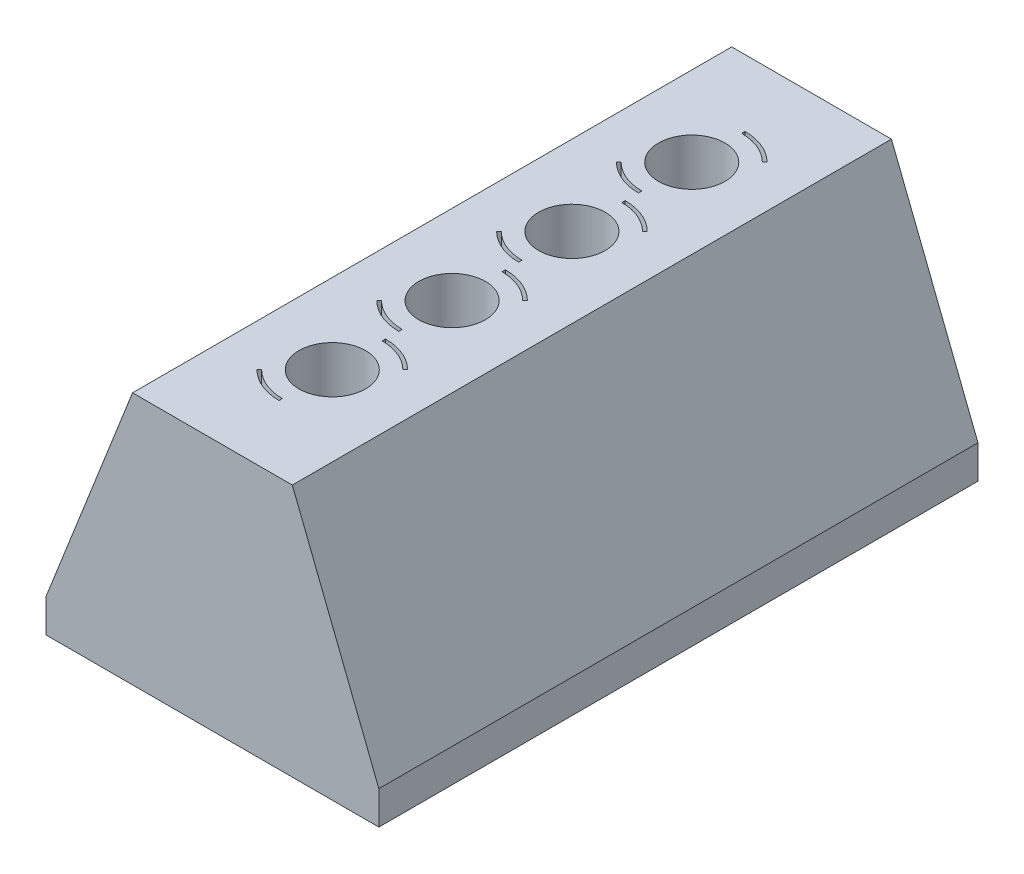
from build123d import *

# Parameters (mm, degrees)
ESTRUSIONE_ESTRUSIONE1_DEPTH = 225
TAGLIO_ESTRUSIONE1_DEPTH     = 90
SVUOTA1_T                    = -15
TAGLIO_ESTRUSIONE2_START     = -20
SCHIZZO4_R                   = 40
TAGLIO_ESTRUSIONE2_DEPTH     = 20
ESTRUSIONE_ESTRUSIONE2_START = 10
SCHIZZO6_W                   = 154.725791786
SCHIZZO6_H                   = 435
SCHIZZO6_R                   = 40
ESTRUSIONE_ESTRUSIONE2_DEPTH = 10
ESTRUSIONE_ESTRUSIONE3_DEPTH = 15
TAGLIO_ESTRUSIONE12_DEPTH    = 491.866580651
TAGLIO_ESTRUSIONE13_DEPTH    = 20


with BuildPart() as part:
    # Schizzo1 → Estrusione-Estrusione1 (new, symmetric)
    with BuildSketch(Plane.XY):
        Polygon((-125, 0), (125, 0), (125, 25), (60, 190), (-60, 190), (-125, 25), align=None)
    extrude(amount=ESTRUSIONE_ESTRUSIONE1_DEPTH, both=True)

    # Schizzo2 → Taglio-Estrusione1 (cut)
    with BuildSketch(Plane(origin=(0, 190, 0), x_dir=(1, 0, 0), z_dir=(0, 1, 0))):
        with BuildLine():
            ThreePointArc((0, -110), (-25, -135), (0, -160))
            Line((0, -160), (0, -135))
            Line((0, -135), (0, -110))
        make_face()
        with BuildLine():
            Line((0, -135), (0, -160))
            ThreePointArc((0, -160), (17.67766953, -152.67766953), (25, -135))
            ThreePointArc((25, -135), (17.67766953, -117.32233047), (0, -110))
            Line((0, -110), (0, -135))
        make_face()
        with BuildLine():
            ThreePointArc((0, -20), (-25, -45), (0, -70))
            Line((0, -70), (0, -45))
            Line((0, -45), (0, -20))
        make_face()
        with BuildLine():
            Line((0, -45), (0, -70))
            ThreePointArc((0, -70), (17.67766953, -62.67766953), (25, -45))
            ThreePointArc((25, -45), (17.67766953, -27.32233047), (0, -20))
            Line((0, -20), (0, -45))
        make_face()
        with BuildLine():
            ThreePointArc((0, 70), (-25, 45), (0, 20))
            Line((0, 20), (0, 45))
            Line((0, 45), (0, 70))
        make_face()
        with BuildLine():
            Line((0, 45), (0, 20))
            ThreePointArc((0, 20), (17.67766953, 27.32233047), (25, 45))
            ThreePointArc((25, 45), (17.67766953, 62.67766953), (0, 70))
            Line((0, 70), (0, 45))
        make_face()
        with BuildLine():
            ThreePointArc((0, 160), (-25, 135), (0, 110))
            Line((0, 110), (0, 135))
            Line((0, 135), (0, 160))
        make_face()
        with BuildLine():
            Line((0, 135), (0, 110))
            ThreePointArc((0, 110), (17.67766953, 117.32233047), (25, 135))
            ThreePointArc((25, 135), (17.67766953, 152.67766953), (0, 160))
            Line((0, 160), (0, 135))
        make_face()
    extrude(amount=-TAGLIO_ESTRUSIONE1_DEPTH, mode=Mode.SUBTRACT)

    # Svuota1
    svuota1_openings = [part.faces().sort_by_distance(p)[0] for p in [
        (0, 83.334466349, 225),
    ]]
    offset(amount=SVUOTA1_T, openings=svuota1_openings, kind=Kind.INTERSECTION)

    # Schizzo4 → Taglio-Estrusione2 (cut)
    with BuildSketch(Plane.XZ.offset(-85).offset(TAGLIO_ESTRUSIONE2_START)):
        with Locations(Location((0, -135, 0), (0, 0, 90))):
            Circle(SCHIZZO4_R)
        with Locations(Location((0, -45, 0), (0, 0, 90))):
            Circle(SCHIZZO4_R)
        with Locations(Location((0, 45, 0), (0, 0, 90))):
            Circle(SCHIZZO4_R)
        with Locations(Location((0, 135, 0), (0, 0, 90))):
            Circle(SCHIZZO4_R)
    extrude(amount=TAGLIO_ESTRUSIONE2_DEPTH, mode=Mode.SUBTRACT)

    # Schizzo6 → Estrusione-Estrusione2 (add)
    with BuildSketch(Plane(origin=(0, 105, 0), x_dir=(1, 0, 0), z_dir=(0, 1, 0)).offset(ESTRUSIONE_ESTRUSIONE2_START)):
        with Locations((0, -7.5)):
            Rectangle(SCHIZZO6_W, SCHIZZO6_H)
        with Locations(Location((0, 135, 0), (0, 0, 270))):
            Circle(SCHIZZO6_R, mode=Mode.SUBTRACT)
        with Locations(Location((0, 45, 0), (0, 0, 270))):
            Circle(SCHIZZO6_R, mode=Mode.SUBTRACT)
        with Locations(Location((0, -45, 0), (0, 0, 270))):
            Circle(SCHIZZO6_R, mode=Mode.SUBTRACT)
        with Locations(Location((0, -135, 0), (0, 0, 270))):
            Circle(SCHIZZO6_R, mode=Mode.SUBTRACT)
    extrude(amount=-ESTRUSIONE_ESTRUSIONE2_DEPTH)

    # Schizzo7 → Estrusione-Estrusione3 (add)
    with BuildSketch(Plane.XY.offset(225)):
        Polygon((-125, 25), (-125, 0), (125, 0), (125, 25), (60, 190), (-60, 190), align=None)
    extrude(amount=-ESTRUSIONE_ESTRUSIONE3_DEPTH)

    # Schizzo12 → Taglio-Estrusione12 (cut, through all)
    with BuildSketch(Plane.XY.offset(-210)):
        with BuildLine():
            ThreePointArc((35, 60), (24.748737342, 84.748737342), (0, 95))
            Line((0, 95), (0, 25))
            ThreePointArc((0, 25), (24.748737342, 35.251262658), (35, 60))
        make_face()
        with BuildLine():
            Line((0, 25), (0, 95))
            ThreePointArc((0, 95), (-35, 60), (0, 25))
        make_face()
    extrude(amount=-TAGLIO_ESTRUSIONE12_DEPTH, mode=Mode.SUBTRACT)

    # Schizzo13 → Taglio-Estrusione13 (cut)
    with BuildSketch(Plane(origin=(0, 190, 0), x_dir=(1, 0, 0), z_dir=(0, 1, 0))):
        with BuildLine():
            Line((0, 97.5), (0, 95))
            ThreePointArc((0, 95), (-15.307337295, 98.0448187), (-28.284271247, 106.715728753))
            Line((-28.284271247, 106.715728753), (-26.516504294, 108.483495706))
            ThreePointArc((-26.516504294, 108.483495706), (-14.350628714, 100.354517531), (0, 97.5))
        make_face()
        with BuildLine():
            Line((26.516504294, 161.516504294), (28.284271247, 163.284271247))
            ThreePointArc((28.284271247, 163.284271247), (15.307337295, 171.9551813), (0, 175))
            Line((0, 175), (0, 172.5))
            ThreePointArc((0, 172.5), (14.350628714, 169.645482469), (26.516504294, 161.516504294))
        make_face()
        with BuildLine():
            Line((-26.516504294, 18.483495706), (-28.284271247, 16.715728753))
            ThreePointArc((-28.284271247, 16.715728753), (-15.307337295, 8.0448187), (0, 5))
            Line((0, 5), (0, 7.5))
            ThreePointArc((0, 7.5), (-14.350628714, 10.354517531), (-26.516504294, 18.483495706))
        make_face()
        with BuildLine():
            Line((26.516504294, 71.516504294), (28.284271247, 73.284271247))
            ThreePointArc((28.284271247, 73.284271247), (15.307337295, 81.9551813), (0, 85))
            Line((0, 85), (0, 82.5))
            ThreePointArc((0, 82.5), (14.350628714, 79.645482469), (26.516504294, 71.516504294))
        make_face()
        with BuildLine():
            Line((-26.516504294, -71.516504294), (-28.284271247, -73.284271247))
            ThreePointArc((-28.284271247, -73.284271247), (-15.307337295, -81.9551813), (0, -85))
            Line((0, -85), (0, -82.5))
            ThreePointArc((0, -82.5), (-14.350628714, -79.645482469), (-26.516504294, -71.516504294))
        make_face()
        with BuildLine():
            Line((26.516504294, -18.483495706), (28.284271247, -16.715728753))
            ThreePointArc((28.284271247, -16.715728753), (15.307337295, -8.0448187), (0, -5))
            Line((0, -5), (0, -7.5))
            ThreePointArc((0, -7.5), (14.350628714, -10.354517531), (26.516504294, -18.483495706))
        make_face()
        with BuildLine():
            Line((-26.516504294, -161.516504294), (-28.284271247, -163.284271247))
            ThreePointArc((-28.284271247, -163.284271247), (-15.307337295, -171.9551813), (0, -175))
            Line((0, -175), (0, -172.5))
            ThreePointArc((0, -172.5), (-14.350628714, -169.645482469), (-26.516504294, -161.516504294))
        make_face()
        with BuildLine():
            Line((26.516504294, -108.483495706), (28.284271247, -106.715728753))
            ThreePointArc((28.284271247, -106.715728753), (15.307337295, -98.0448187), (0, -95))
            Line((0, -95), (0, -97.5))
            ThreePointArc((0, -97.5), (14.350628714, -100.354517531), (26.516504294, -108.483495706))
        make_face()
    extrude(amount=-TAGLIO_ESTRUSIONE13_DEPTH, mode=Mode.SUBTRACT)


solid = part.part
